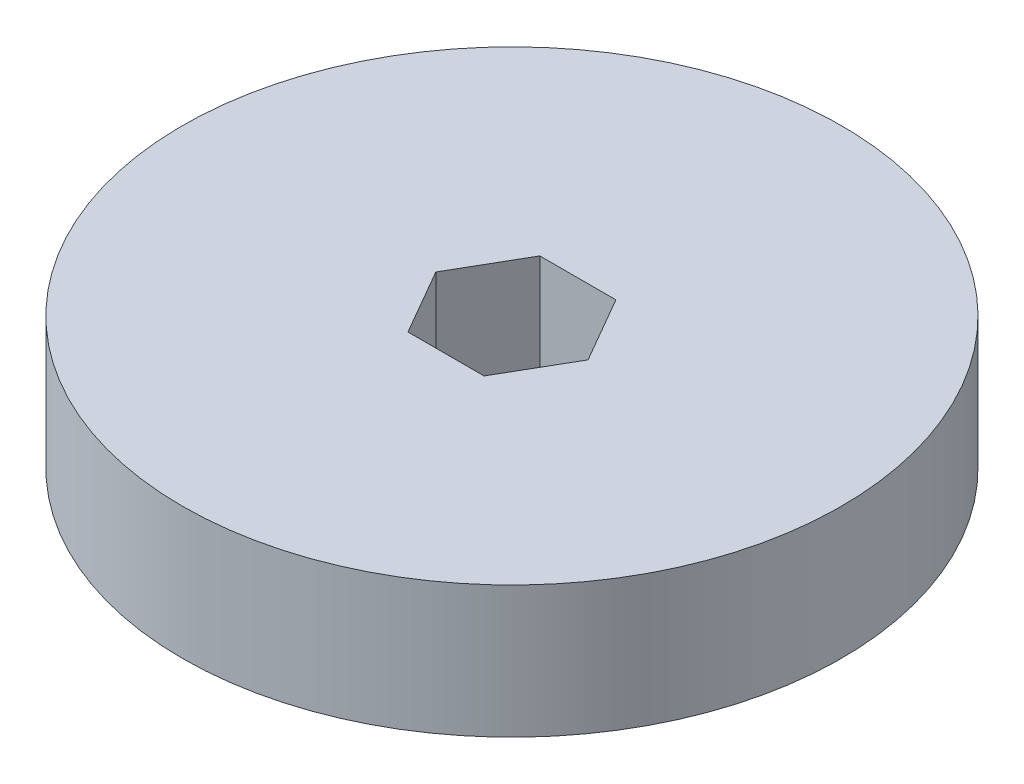
from build123d import *

# Parameters (mm, degrees)
SKETCH1_R           = 31.75
BOSS_EXTRUDE1_DEPTH = 12.7


with BuildPart() as part:
    # Sketch1 → Boss-Extrude1 (new body)
    with BuildSketch(Plane(origin=(0, 0, 0), x_dir=(1, 0, 0), z_dir=(0, 1, 0))):
        with Locations(Location((0, 0, 0), (0, 0, 270))):
            Circle(SKETCH1_R)
        Polygon((-7.332348419, 0), (-3.666174209, -6.35), (3.666174209, -6.35), (7.332348419, 0), (3.666174209, 6.35), (-3.666174209, 6.35), align=None, mode=Mode.SUBTRACT)
    extrude(amount=BOSS_EXTRUDE1_DEPTH)


solid = part.part
